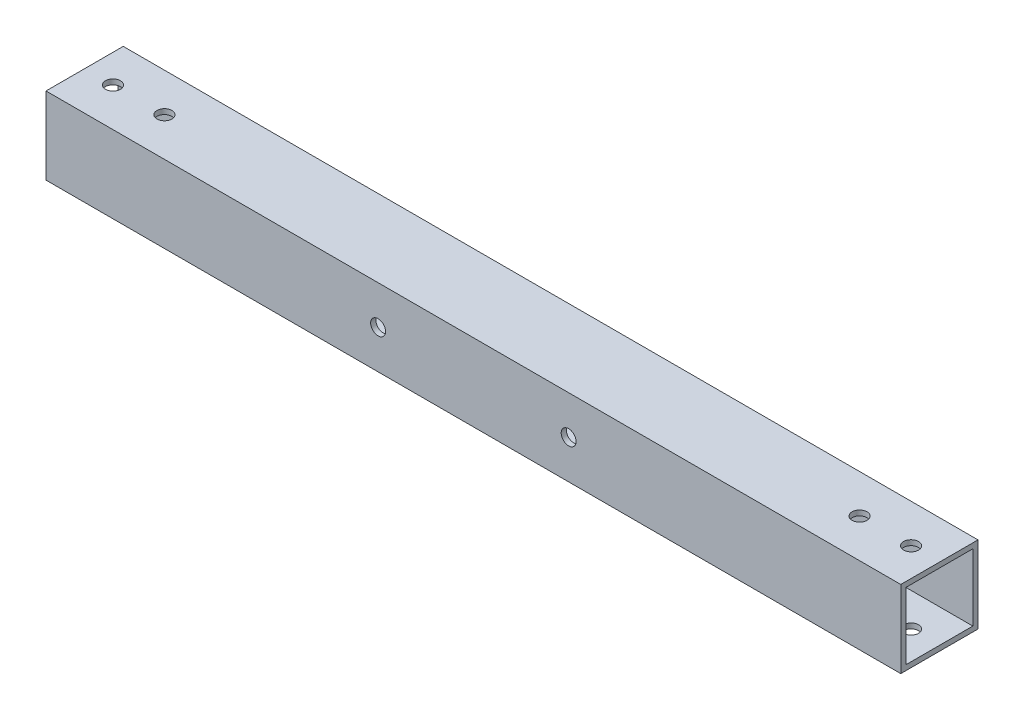
from build123d import *

# Parameters (mm, degrees)
SKETCH_11_W         = 15
SKETCH_11_H         = 15
SKETCH_11_W_2       = 13
SKETCH_11_H_2       = 13
F_15X15X1_1_DEPTH   = 166
SKETCH_12_R         = 1.45
CUT_EXTRUDE_1_DEPTH = 85.677328725
SKETCH_13_R         = 1.45
CUT_EXTRUDE_2_DEPTH = 85.677328725


with BuildPart() as part:
    # 草图11 → 铝管 15X15X1(1) (new body)
    with BuildSketch(Plane(origin=(-83, 0, 0), x_dir=(0, 0, -1), z_dir=(1, 0, 0))):
        Rectangle(SKETCH_11_W, SKETCH_11_H)
        Rectangle(SKETCH_11_W_2, SKETCH_11_H_2, mode=Mode.SUBTRACT)
    extrude(amount=F_15X15X1_1_DEPTH)

    # 草图12 → 切除-拉伸1 (cut, through all)
    with BuildSketch(Plane(origin=(0, 0, -7.5), x_dir=(-1, 0, 0), z_dir=(0, 0, -1))):
        with Locations((-18.5, 0)):
            Circle(SKETCH_12_R)
        with Locations((18.5, 0)):
            Circle(SKETCH_12_R)
    extrude(amount=-CUT_EXTRUDE_1_DEPTH, mode=Mode.SUBTRACT)

    # 草图13 → 切除-拉伸2 (cut, through all)
    with BuildSketch(Plane.XZ.offset(7.5)):
        with Locations(Location((-77.5, 0, 0), (0, 0, 270))):
            Circle(SKETCH_13_R)
        with Locations(Location((-67.5, 0, 0), (0, 0, 270))):
            Circle(SKETCH_13_R)
        with Locations(Location((67.5, 0, 0), (0, 0, 270))):
            Circle(SKETCH_13_R)
        with Locations(Location((77.5, 0, 0), (0, 0, 270))):
            Circle(SKETCH_13_R)
    extrude(amount=-CUT_EXTRUDE_2_DEPTH, mode=Mode.SUBTRACT)


solid = part.part
